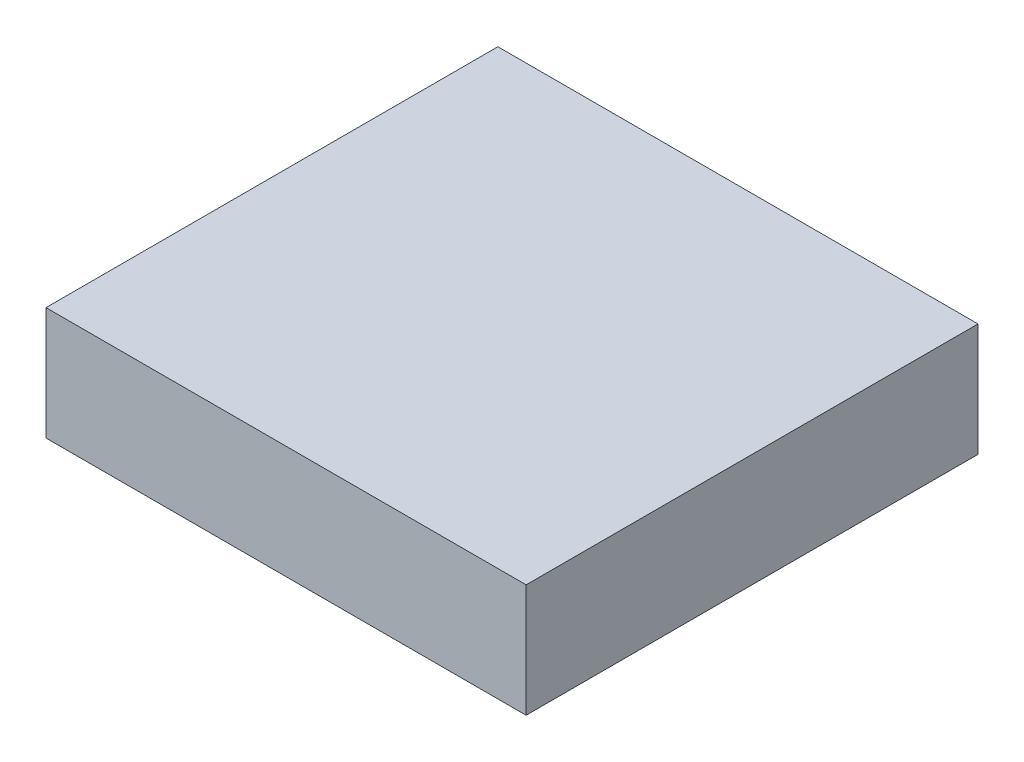
from build123d import *

# Parameters (mm, degrees)
ESBO_O2_W                = 51
ESBO_O2_H                = 48
RESSALTO_EXTRUS_O1_DEPTH = 12


with BuildPart() as part:
    # Esboço2 → Ressalto-extrusão1 (new body)
    with BuildSketch(Plane(origin=(0, 0, 0), x_dir=(1, 0, 0), z_dir=(0, 1, 0))):
        Rectangle(ESBO_O2_W, ESBO_O2_H)
    extrude(amount=RESSALTO_EXTRUS_O1_DEPTH)


solid = part.part
